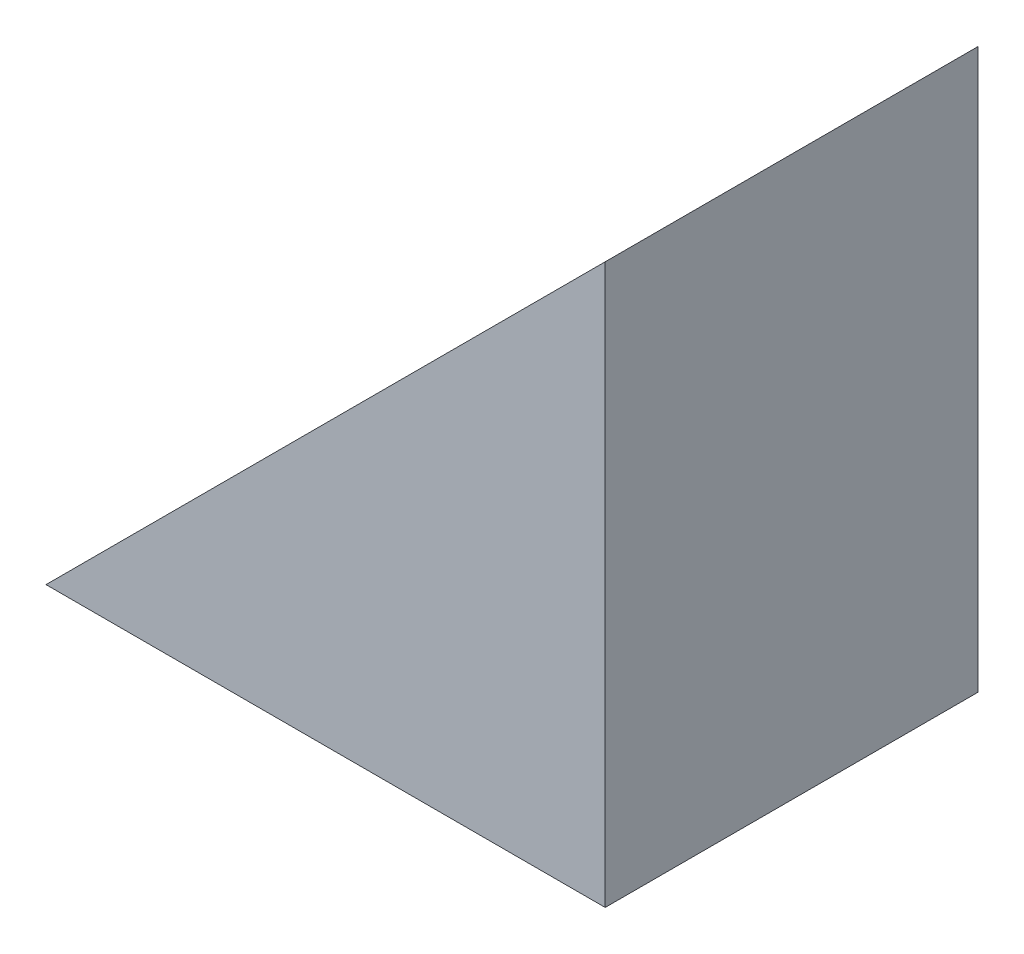
from build123d import *

# Parameters (mm, degrees)
BOSS_EXTRU_1_DEPTH = 50.8


with BuildPart() as part:
    # Esquisse1 → Boss.-Extru.1 (new body)
    with BuildSketch(Plane.XY):
        Polygon((0, 0), (-76.2, 0), (0, 76.2), align=None)
    extrude(amount=-BOSS_EXTRU_1_DEPTH)


solid = part.part
